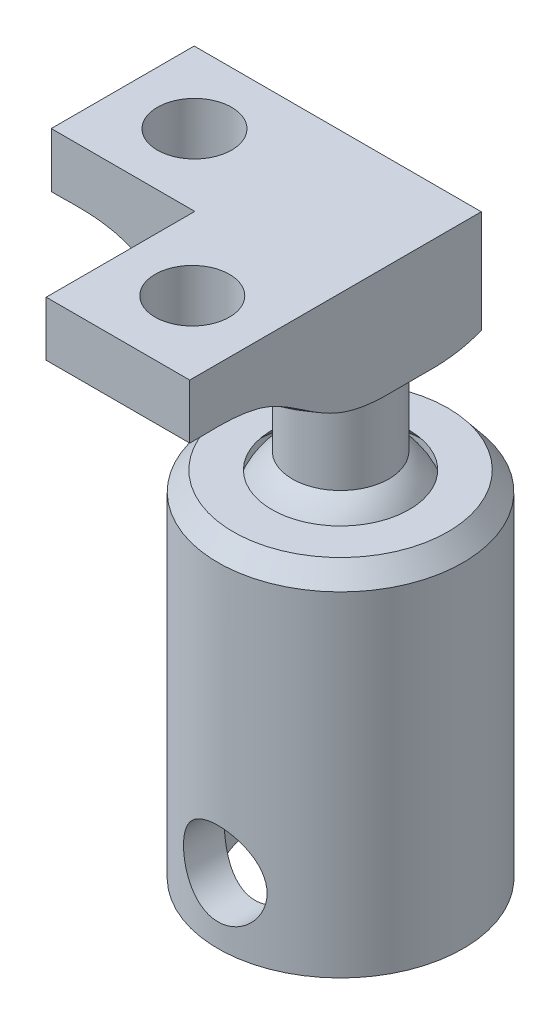
from build123d import *

# Parameters (mm, degrees)
SALIENTE_EXTRUIR1_DEPTH      = 2
SALIENTE_EXTRUIR1_DEPTH_BACK = 4
CROQUIS5_R                   = 2.6
CROQUIS6_W                   = 7.455384582
CROQUIS6_H                   = 7.695177654
SALIENTE_EXTRUIR2_DEPTH      = 6
CROQUIS14_W                  = 7.695177654
CROQUIS14_H                  = 6
SALIENTE_EXTRUIR4_DEPTH      = 8
CROQUIS15_W                  = 7.727692291
CROQUIS15_H                  = 6
SALIENTE_EXTRUIR5_DEPTH      = 8
CORTAR_EXTRUIR3_REACH        = 37.198
CROQUIS19_R                  = 2
CROQUIS4_R                   = 2.25
CORTAR_EXTRUIR2_DEPTH        = 23


with BuildPart() as part:
    # Croquis2 → Revolución2 (revolve)
    with BuildSketch(Plane.XY, mode=Mode.PRIVATE) as revoluci_n2_sk:
        with BuildLine():
            Line((4.6, 0), (6.6, 0))
            Line((6.6, 0), (6.6, 18))
            Line((6.6, 18), (5.777341974, 19.021942148))
            Line((5.777341974, 19.021942148), (3.7, 19.021942148))
            Line((3.7, 19.021942148), (4.6, 18.067409811))
            Line((4.6, 18.067409811), (4.6, 14.1))
            ThreePointArc((4.6, 14.1), (3.3, 12.8), (4.6, 11.5))
            Line((4.6, 11.5), (4.6, 0))
        make_face()
        with BuildLine():
            Line((0, 12.427205883), (0, 20.8))
            ThreePointArc((0, 20.8), (4.193193013, 16.839023752), (0.477272727, 12.427205883))
            Line((0.477272727, 12.427205883), (0, 12.427205883))
        make_face()
    revolve(revoluci_n2_sk.sketch.rotate(Axis((0, 12.427205883, 0), (0, 1, 0)), 90), axis=Axis((0, 12.427205883, 0), (0, 1, 0)))

    # Croquis5 → Saliente-Extruir1 (add, two sides: drawn at the far end of the back side and taken through both)
    with BuildSketch(Plane(origin=(0, 23, 0), x_dir=(1, 0, 0), z_dir=(0, 1, 0)).offset(-SALIENTE_EXTRUIR1_DEPTH_BACK)):
        with Locations(Location((0, 0, 0), (0, 0, 270))):
            Circle(CROQUIS5_R)
    extrude(amount=SALIENTE_EXTRUIR1_DEPTH + SALIENTE_EXTRUIR1_DEPTH_BACK)

    # Croquis6 → Saliente-Extruir2 (add)
    with BuildSketch(Plane(origin=(0, 25, 0), x_dir=(1, 0, 0), z_dir=(0, 1, 0))):
        Rectangle(CROQUIS6_W, CROQUIS6_H)
    extrude(amount=SALIENTE_EXTRUIR2_DEPTH)

    # Croquis14 → Saliente-Extruir4 (add)
    with BuildSketch(Plane.ZY.offset(3.727692291)):
        with Locations((0, 28)):
            Rectangle(CROQUIS14_W, CROQUIS14_H)
    extrude(amount=SALIENTE_EXTRUIR4_DEPTH)

    # Croquis15 → Saliente-Extruir5 (add)
    with BuildSketch(Plane.XY.offset(3.847588827)):
        with Locations((-0.136153854, 28)):
            Rectangle(CROQUIS15_W, CROQUIS15_H)
    extrude(amount=SALIENTE_EXTRUIR5_DEPTH)

    # Croquis18 → Cortar-Revolución10 (revolve, cut)
    with BuildSketch(Plane.XY, mode=Mode.PRIVATE) as cortar_revoluci_n10_sk:
        with BuildLine():
            Line((-11.727692291, 28.05919163), (-12.864657385, 28.05919163))
            Line((-12.864657385, 28.05919163), (-12.864657385, 21.834544707))
            Line((-12.864657385, 21.834544707), (-4, 21.967561285))
            Line((-4, 21.967561285), (-4, 25))
            add(Edge.make_bspline(
                [(-4, 25), (-5.832624906, 25.226776739), (-7.607503572, 28.057043883), (-10.687102248, 28.095564604), (-11.727692291, 28.05919163)],
                knots=[0, 0, 0, 0, 0.62319476, 1, 1, 1, 1], degree=3))
        make_face()
    revolve(cortar_revoluci_n10_sk.sketch.rotate(Axis((0, 25, 0), (0, 1, 0)), 180), axis=Axis((0, 25, 0), (0, 1, 0)), mode=Mode.SUBTRACT)

    # Croquis19 → Cortar-Extruir3 (cut, up to next)
    with BuildSketch(Plane(origin=(0, 31, 0), x_dir=(1, 0, 0), z_dir=(0, 1, 0)), mode=Mode.PRIVATE) as cortar_extruir3_sk1:
        with Locations(Location((-7.863846145, 0, 0), (0, 0, 270))):
            Circle(CROQUIS19_R)
    cortar_extruir3_tool1 = extrude(cortar_extruir3_sk1.sketch, amount=-CORTAR_EXTRUIR3_REACH, mode=Mode.PRIVATE) & part.part
    # Croquis19 → Cortar-Extruir3 (cut, up to next)
    with BuildSketch(Plane(origin=(0, 31, 0), x_dir=(1, 0, 0), z_dir=(0, 1, 0)), mode=Mode.PRIVATE) as cortar_extruir3_sk2:
        with Locations(Location((-0.136153855, -7.847588827, 0), (0, 0, 270))):
            Circle(CROQUIS19_R)
    cortar_extruir3_tool2 = extrude(cortar_extruir3_sk2.sketch, amount=-CORTAR_EXTRUIR3_REACH, mode=Mode.PRIVATE) & part.part
    add(cortar_extruir3_tool1.solids().sort_by_distance((-7.863846, 31, 0))[0], mode=Mode.SUBTRACT)
    add(cortar_extruir3_tool2.solids().sort_by_distance((-0.136154, 31, 7.847589))[0], mode=Mode.SUBTRACT)

    # Croquis4 → Cortar-Extruir2 (cut)
    with BuildSketch(Plane.XY.offset(-8)):
        with Locations(Location((0, 3.5, 0), (0, 0, 180))):
            Circle(CROQUIS4_R)
    extrude(amount=CORTAR_EXTRUIR2_DEPTH, mode=Mode.SUBTRACT)


solid = part.part
